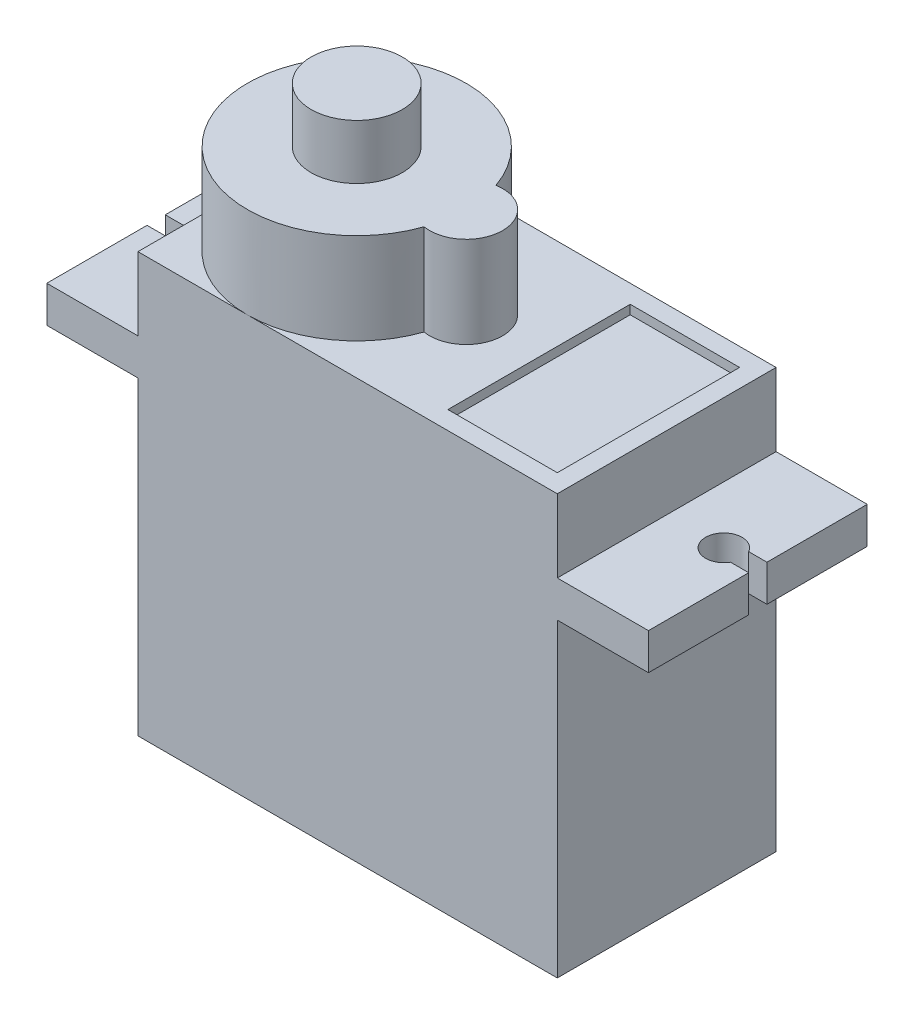
from build123d import *

# Parameters (mm, degrees)
SKETCH1_W           = 23
SKETCH1_H           = 12
BOSS_EXTRUDE1_DEPTH = 23
BOSS_EXTRUDE2_DEPTH = 5
SKETCH3_W           = 12
SKETCH3_H           = 2
BOSS_EXTRUDE3_DEPTH = 5
CUT_EXTRUDE1_START  = -5
CUT_EXTRUDE1_DEPTH  = 41.902646142
SKETCH5_R           = 2.5
BOSS_EXTRUDE4_DEPTH = 3
SKETCH6_W           = 6
SKETCH6_H           = 10
CUT_EXTRUDE2_DEPTH  = 0.5
SKETCH7_W           = 3
SKETCH7_H           = 1
CUT_EXTRUDE3_DEPTH  = 1


with BuildPart() as part:
    # Sketch1 → Boss-Extrude1 (new body)
    with BuildSketch(Plane(origin=(0, 0, 0), x_dir=(1, 0, 0), z_dir=(0, 1, 0))):
        with Locations((11.5, 6)):
            Rectangle(SKETCH1_W, SKETCH1_H)
    extrude(amount=BOSS_EXTRUDE1_DEPTH)

    # Sketch2 → Boss-Extrude2 (add)
    with BuildSketch(Plane(origin=(0, 23, 0), x_dir=(1, 0, 0), z_dir=(0, 1, 0))):
        with BuildLine():
            ThreePointArc((11.666666667, 7.972026594), (0, 6), (11.666666667, 4.027973406))
            ThreePointArc((11.666666667, 4.027973406), (14, 6), (11.666666667, 7.972026594))
        make_face()
    extrude(amount=BOSS_EXTRUDE2_DEPTH)

    # Sketch3 → Boss-Extrude3 (add)
    with BuildSketch(Plane(origin=(23, 0, 0), x_dir=(0, 0, -1), z_dir=(1, 0, 0))):
        with Locations((6, 18)):
            Rectangle(SKETCH3_W, SKETCH3_H)
    boss_extrude3 = extrude(amount=BOSS_EXTRUDE3_DEPTH)

    # Sketch4 → Cut-Extrude1 (cut)
    with BuildSketch(Plane(origin=(0, 19, 0), x_dir=(1, 0, 0), z_dir=(0, 1, 0)).offset(CUT_EXTRUDE1_START)):
        with BuildLine():
            Line((28, 6.5), (27, 6.5))
            ThreePointArc((27, 6.5), (25.133974596, 6), (27, 5.5))
            Line((27, 5.5), (28, 5.5))
            Line((28, 5.5), (28, 6.5))
        make_face()
    cut_extrude1 = extrude(amount=CUT_EXTRUDE1_DEPTH, mode=Mode.SUBTRACT)

    # Mirror3: Boss-Extrude3, Cut-Extrude1 across plane
    add(boss_extrude3.mirror(Plane.ZY.offset(-11.5)))
    add(cut_extrude1.mirror(Plane.ZY.offset(-11.5)), mode=Mode.SUBTRACT)

    # Sketch5 → Boss-Extrude4 (add)
    with BuildSketch(Plane(origin=(0, 28, 0), x_dir=(1, 0, 0), z_dir=(0, 1, 0))):
        with Locations(Location((6, 6, 0), (0, 0, 270))):
            Circle(SKETCH5_R)
    extrude(amount=BOSS_EXTRUDE4_DEPTH)

    # Sketch6 → Cut-Extrude2 (cut)
    with BuildSketch(Plane(origin=(0, 23, 0), x_dir=(1, 0, 0), z_dir=(0, 1, 0))):
        with Locations((19, 6)):
            Rectangle(SKETCH6_W, SKETCH6_H)
    extrude(amount=-CUT_EXTRUDE2_DEPTH, mode=Mode.SUBTRACT)

    # Sketch7 → Cut-Extrude3 (cut)
    with BuildSketch(Plane.ZY):
        with Locations((-6, 5.5)):
            Rectangle(SKETCH7_W, SKETCH7_H)
    extrude(amount=-CUT_EXTRUDE3_DEPTH, mode=Mode.SUBTRACT)


solid = part.part
